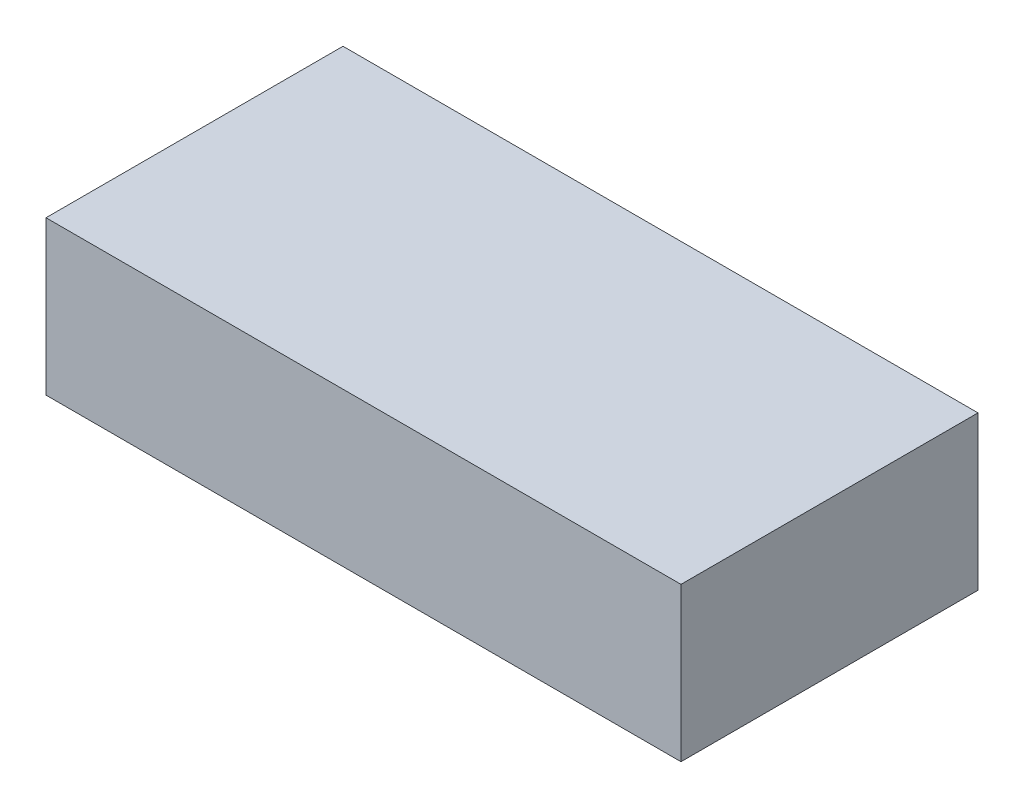
from build123d import *

# Parameters (mm, degrees)
SKETCH_1_W      = 62
SKETCH_1_H      = 29
EXTRUDE_1_DEPTH = 15


with BuildPart() as part:
    # 草图1 → 凸台-拉伸1 (new body)
    with BuildSketch(Plane(origin=(0, 0, 0), x_dir=(1, 0, 0), z_dir=(0, 1, 0))):
        with Locations((31, 14.5)):
            Rectangle(SKETCH_1_W, SKETCH_1_H)
    extrude(amount=EXTRUDE_1_DEPTH)


solid = part.part
